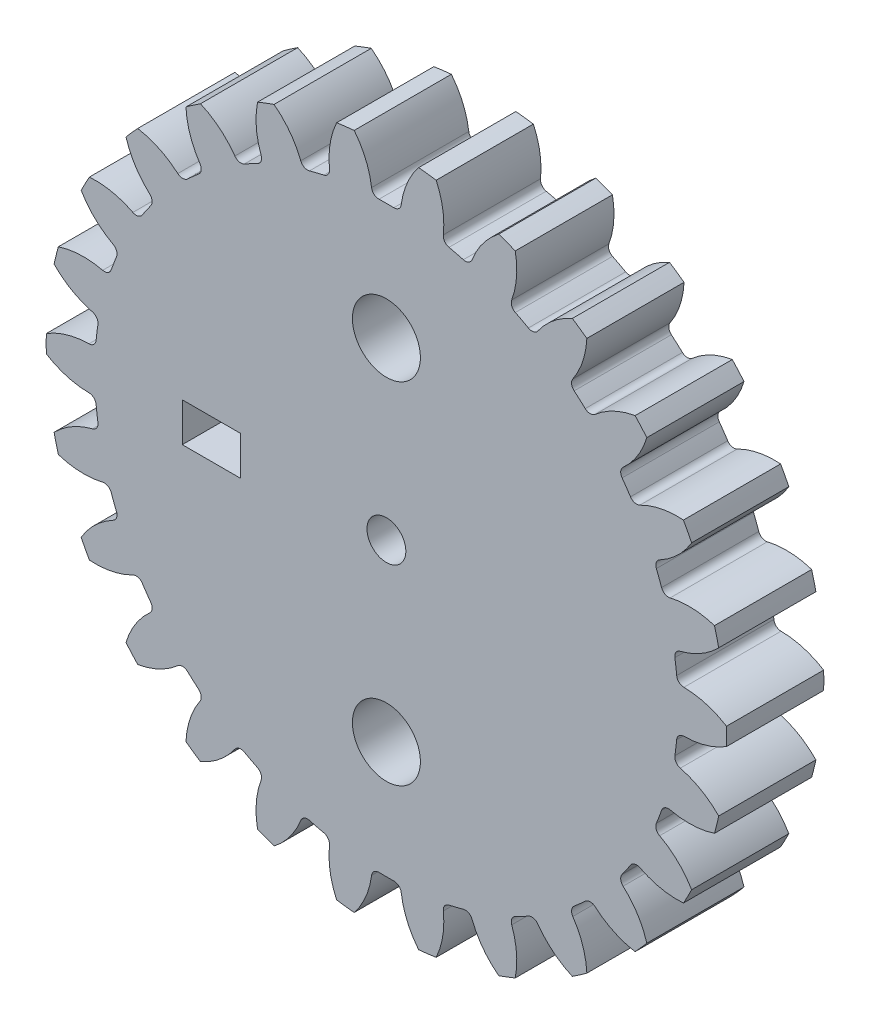
from build123d import *

# Parameters (mm, degrees)
SKETCH1_R                   = 17.5
BOSS_EXTRUDE1_DEPTH         = 2.5
CUT_EXTRUDE1_DEPTH          = 25.874685928
FILLET2_R                   = 0.375
CIRPATTERN1_COUNT           = 26
FILLET2_OF_CIRPATTERN1_R    = 0.375
STRING_HOLE_DEPTH           = 25.819388405
STRING_HOLE_DEPTH_BACK      = 25.819388405
SKETCH4_R                   = 1
TO_KNUCKLE_MOUNT_DEPTH      = 25.819388405
TO_KNUCKLE_MOUNT_DEPTH_BACK = 25.819388405
SKETCH5_R                   = 1.75
SKETCH7_W                   = 3
SKETCH7_H                   = 2
FOR_ALIGNMENT_DEPTH         = 2


with BuildPart() as part:
    # Sketch1 → Boss-Extrude1 (new, symmetric)
    with BuildSketch(Plane.XY):
        Circle(SKETCH1_R)
    extrude(amount=BOSS_EXTRUDE1_DEPTH, both=True)

    # Sketch3 → Cut-Extrude1 (cut, symmetric)
    with BuildSketch(Plane.XY):
        with BuildLine():
            ThreePointArc((-0.731537344, 14.982151151), (0, 15), (0.731537344, 14.982151151))
            ThreePointArc((0.731537344, 14.982151151), (1.001492244, 16.275061461), (1.657699213, 17.421309748))
            ThreePointArc((1.657699213, 17.421309748), (0, 17.5), (-1.657699213, 17.421309748))
            ThreePointArc((-1.657699213, 17.421309748), (-1.001492244, 16.275061461), (-0.731537344, 14.982151151))
        make_face()
    cut_extrude1 = extrude(amount=CUT_EXTRUDE1_DEPTH, both=True, mode=Mode.SUBTRACT)

    # Fillet2
    fillet2_edges = [part.edges().sort_by_distance(p)[0] for p in [
        (0.731537344, 14.982151151, 0),
        (-0.731537344, 14.982151151, 0),
    ]]
    fillet(fillet2_edges, radius=FILLET2_R)

    # CirPattern1: Cut-Extrude1 ×26 about axis
    cirpattern1_axis = Axis((0, 0, 0), (0, 0, 1))
    for i in range(1, CIRPATTERN1_COUNT):
        add(cut_extrude1.rotate(cirpattern1_axis, i * 360 / CIRPATTERN1_COUNT), mode=Mode.SUBTRACT)

    # Fillet2 of CirPattern1
    fillet2_of_cirpattern1_edges = [part.edges().sort_by_distance(p)[0] for p in [
        (-2.875183257, 14.721865413, 0),
        (-4.295743653, 14.371728722, 0),
        (-6.314808658, 13.605998369, 0),
        (-7.610296956, 12.926073659, 0),
        (-9.387440333, 11.699400155, 0),
        (-10.482567462, 10.729202179, 0),
        (-11.914508098, 9.11287533, 0),
        (-12.74562925, 7.908788468, 0),
        (-13.74914796, 5.996743315, 0),
        (-14.267961394, 4.628744718, 0),
        (-14.784737318, 2.532102376, 0),
        (-14.961091484, 1.07969515, 0),
        (-14.961091484, -1.07969515, 0),
        (-14.784737318, -2.532102376, 0),
        (-14.267961394, -4.628744718, 0),
        (-13.74914796, -5.996743315, 0),
        (-12.74562925, -7.908788468, 0),
        (-11.914508098, -9.11287533, 0),
        (-10.482567462, -10.729202179, 0),
        (-9.387440333, -11.699400155, 0),
        (-7.610296956, -12.926073659, 0),
        (-6.314808658, -13.605998369, 0),
        (-4.295743653, -14.371728722, 0),
        (-2.875183257, -14.721865413, 0),
        (-0.731537344, -14.982151151, 0),
        (0.731537344, -14.982151151, 0),
        (2.875183257, -14.721865413, 0),
        (4.295743653, -14.371728722, 0),
        (6.314808658, -13.605998369, 0),
        (7.610296956, -12.926073659, 0),
        (9.387440333, -11.699400155, 0),
        (10.482567462, -10.729202179, 0),
        (11.914508098, -9.11287533, 0),
        (12.74562925, -7.908788468, 0),
        (13.74914796, -5.996743315, 0),
        (14.267961394, -4.628744718, 0),
        (14.784737318, -2.532102376, 0),
        (14.961091484, -1.07969515, 0),
        (14.961091484, 1.07969515, 0),
        (14.784737318, 2.532102376, 0),
        (14.267961394, 4.628744718, 0),
        (13.74914796, 5.996743315, 0),
        (12.74562925, 7.908788468, 0),
        (11.914508098, 9.11287533, 0),
        (10.482567462, 10.729202179, 0),
        (9.387440333, 11.699400155, 0),
        (7.610296956, 12.926073659, 0),
        (6.314808658, 13.605998369, 0),
        (4.295743653, 14.371728722, 0),
        (2.875183257, 14.721865413, 0),
    ]]
    fillet(fillet2_of_cirpattern1_edges, radius=FILLET2_OF_CIRPATTERN1_R)

    # Sketch4 → String_Hole (cut, two sides: drawn at the far end of the back side and taken through both)
    with BuildSketch(Plane.XY.offset(-STRING_HOLE_DEPTH_BACK)):
        Circle(SKETCH4_R)
    extrude(amount=STRING_HOLE_DEPTH + STRING_HOLE_DEPTH_BACK, mode=Mode.SUBTRACT)

    # Sketch5 → To_Knuckle_Mount (cut, two sides: drawn at the far end of the back side and taken through both)
    with BuildSketch(Plane.XY.offset(-TO_KNUCKLE_MOUNT_DEPTH_BACK)):
        with Locations((0, 9)):
            Circle(SKETCH5_R)
        with Locations((0, -9)):
            Circle(SKETCH5_R)
    extrude(amount=TO_KNUCKLE_MOUNT_DEPTH + TO_KNUCKLE_MOUNT_DEPTH_BACK, mode=Mode.SUBTRACT)

    # Sketch7 → For_Alignment (cut)
    with BuildSketch(Plane.XY.offset(2.5)):
        with Locations((-9, 0)):
            Rectangle(SKETCH7_W, SKETCH7_H)
    extrude(amount=-FOR_ALIGNMENT_DEPTH, mode=Mode.SUBTRACT)


solid = part.part
